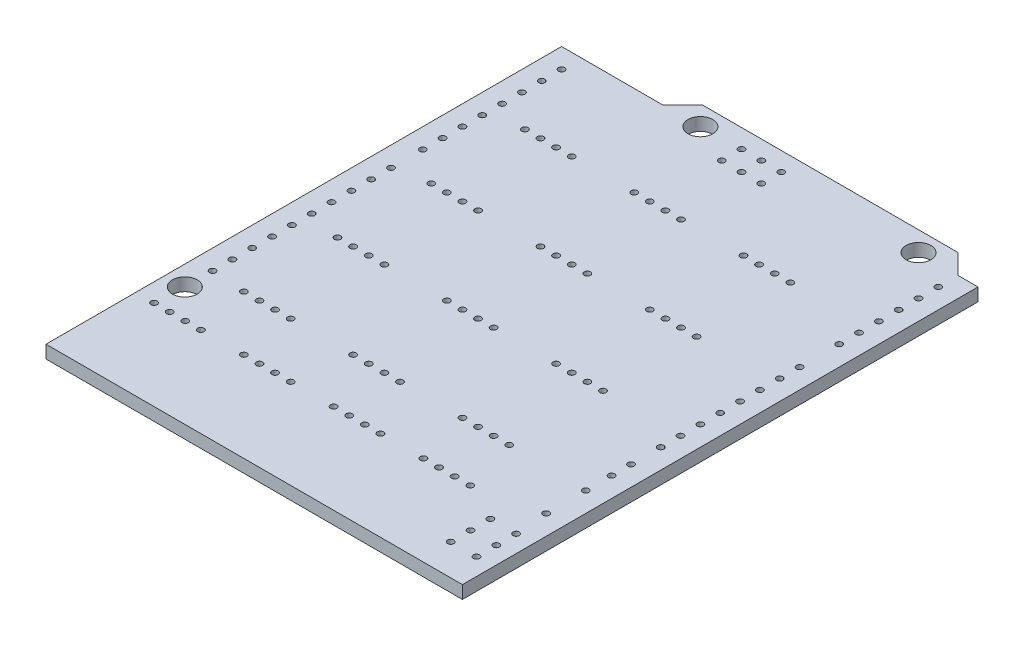
from build123d import *

# Parameters (mm, degrees)
SKETCH1_R                             = 1.5875
BOSS_EXTRUDE1_DEPTH                   = 1.65
SKETCH2_R                             = 0.4
CUT_EXTRUDE1_DEPTH                    = 1.65
SKETCH3_R                             = 0.4
CUT_EXTRUDE2_DEPTH                    = 1.65
LPATTERN1_COUNT                       = 15
LPATTERN1_PITCH                       = 2.54
SKETCH4_R                             = 0.4
CUT_EXTRUDE3_DEPTH                    = 1.65
LPATTERN2_COUNT                       = 10
LPATTERN2_PITCH                       = 2.54
LPATTERN3_COUNT                       = 8
LPATTERN3_PITCH                       = 2.54
SKETCH5_R                             = 0.4
CUT_EXTRUDE4_DEPTH                    = 10
ESQUISSE1_R                           = 0.4
ENL_V_MAT_EXTRU_1_DEPTH               = 10
R_P_TITION_LIN_AIRE1_COUNT            = 4
R_P_TITION_LIN_AIRE1_PITCH            = 2
R_P_TITION_LIN_AIRE1_COUNT_DIR2       = 4
R_P_TITION_LIN_AIRE1_PITCH_DIR2       = 11.5
ESQUISSE2_R                           = 0.4
ENL_V_MAT_EXTRU_2_DEPTH               = 10
R_P_TITION_LIN_AIRE2_COUNT            = 4
R_P_TITION_LIN_AIRE2_PITCH            = 2
R_P_TITION_LIN_AIRE2_COUNT_DIR2       = 3
R_P_TITION_LIN_AIRE2_PITCH_DIR2       = 14
R_P_TITION_LIN_AIRE3_COUNT            = 4
R_P_TITION_LIN_AIRE3_PITCH            = 12
R_P_TITION_LIN_AIRE3_COPY_1_SKETCH_R  = 0.4
R_P_TITION_LIN_AIRE3_COPY_1_DEPTH     = 10
R_P_TITION_LIN_AIRE3_COPY_2_SKETCH_R  = 0.4
R_P_TITION_LIN_AIRE3_COPY_2_DEPTH     = 10
R_P_TITION_LIN_AIRE3_COPY_3_SKETCH_R  = 0.4
R_P_TITION_LIN_AIRE3_COPY_3_DEPTH     = 10
R_P_TITION_LIN_AIRE3_COPY_4_SKETCH_R  = 0.4
R_P_TITION_LIN_AIRE3_COPY_4_DEPTH     = 10
R_P_TITION_LIN_AIRE3_COPY_5_SKETCH_R  = 0.4
R_P_TITION_LIN_AIRE3_COPY_5_DEPTH     = 10
R_P_TITION_LIN_AIRE3_COPY_6_SKETCH_R  = 0.4
R_P_TITION_LIN_AIRE3_COPY_6_DEPTH     = 10
R_P_TITION_LIN_AIRE3_COPY_7_SKETCH_R  = 0.4
R_P_TITION_LIN_AIRE3_COPY_7_DEPTH     = 10
R_P_TITION_LIN_AIRE3_COPY_8_SKETCH_R  = 0.4
R_P_TITION_LIN_AIRE3_COPY_8_DEPTH     = 10
R_P_TITION_LIN_AIRE3_COPY_9_SKETCH_R  = 0.4
R_P_TITION_LIN_AIRE3_COPY_9_DEPTH     = 10
R_P_TITION_LIN_AIRE3_COPY_10_SKETCH_R = 0.4
R_P_TITION_LIN_AIRE3_COPY_10_DEPTH    = 10
R_P_TITION_LIN_AIRE3_COPY_11_SKETCH_R = 0.4
R_P_TITION_LIN_AIRE3_COPY_11_DEPTH    = 10
R_P_TITION_LIN_AIRE3_COPY_12_SKETCH_R = 0.4
R_P_TITION_LIN_AIRE3_COPY_12_DEPTH    = 10
R_P_TITION_LIN_AIRE3_COPY_13_SKETCH_R = 0.4
R_P_TITION_LIN_AIRE3_COPY_13_DEPTH    = 10
R_P_TITION_LIN_AIRE3_COPY_14_SKETCH_R = 0.4
R_P_TITION_LIN_AIRE3_COPY_14_DEPTH    = 10
R_P_TITION_LIN_AIRE3_COPY_15_SKETCH_R = 0.4
R_P_TITION_LIN_AIRE3_COPY_15_DEPTH    = 10
R_P_TITION_LIN_AIRE3_COPY_16_SKETCH_R = 0.4
R_P_TITION_LIN_AIRE3_COPY_16_DEPTH    = 10
R_P_TITION_LIN_AIRE3_COPY_17_SKETCH_R = 0.4
R_P_TITION_LIN_AIRE3_COPY_17_DEPTH    = 10
R_P_TITION_LIN_AIRE3_COPY_18_SKETCH_R = 0.4
R_P_TITION_LIN_AIRE3_COPY_18_DEPTH    = 10
R_P_TITION_LIN_AIRE3_COPY_19_SKETCH_R = 0.4
R_P_TITION_LIN_AIRE3_COPY_19_DEPTH    = 10
R_P_TITION_LIN_AIRE3_COPY_20_SKETCH_R = 0.4
R_P_TITION_LIN_AIRE3_COPY_20_DEPTH    = 10
R_P_TITION_LIN_AIRE3_COPY_21_SKETCH_R = 0.4
R_P_TITION_LIN_AIRE3_COPY_21_DEPTH    = 10
R_P_TITION_LIN_AIRE3_COPY_22_SKETCH_R = 0.4
R_P_TITION_LIN_AIRE3_COPY_22_DEPTH    = 10
R_P_TITION_LIN_AIRE3_COPY_23_SKETCH_R = 0.4
R_P_TITION_LIN_AIRE3_COPY_23_DEPTH    = 10
R_P_TITION_LIN_AIRE3_COPY_24_SKETCH_R = 0.4
R_P_TITION_LIN_AIRE3_COPY_24_DEPTH    = 10
R_P_TITION_LIN_AIRE3_COPY_25_SKETCH_R = 0.4
R_P_TITION_LIN_AIRE3_COPY_25_DEPTH    = 10
R_P_TITION_LIN_AIRE3_COPY_26_SKETCH_R = 0.4
R_P_TITION_LIN_AIRE3_COPY_26_DEPTH    = 10
R_P_TITION_LIN_AIRE3_COPY_27_SKETCH_R = 0.4
R_P_TITION_LIN_AIRE3_COPY_27_DEPTH    = 10
R_P_TITION_LIN_AIRE3_COPY_28_SKETCH_R = 0.4
R_P_TITION_LIN_AIRE3_COPY_28_DEPTH    = 10
R_P_TITION_LIN_AIRE3_COPY_29_SKETCH_R = 0.4
R_P_TITION_LIN_AIRE3_COPY_29_DEPTH    = 10
R_P_TITION_LIN_AIRE3_COPY_30_SKETCH_R = 0.4
R_P_TITION_LIN_AIRE3_COPY_30_DEPTH    = 10
R_P_TITION_LIN_AIRE3_COPY_31_SKETCH_R = 0.4
R_P_TITION_LIN_AIRE3_COPY_31_DEPTH    = 10
R_P_TITION_LIN_AIRE3_COPY_32_SKETCH_R = 0.4
R_P_TITION_LIN_AIRE3_COPY_32_DEPTH    = 10
R_P_TITION_LIN_AIRE3_COPY_33_SKETCH_R = 0.4
R_P_TITION_LIN_AIRE3_COPY_33_DEPTH    = 10


with BuildPart() as part:
    # Sketch1 → Boss-Extrude1 (new body)
    with BuildSketch(Plane(origin=(0, 0, 0), x_dir=(1, 0, 0), z_dir=(0, 1, 0))):
        Polygon((0, 0), (-53.34, 0), (-53.34, 66.04), (-40.386, 66.04), (-37.846, 68.58), (-5.08, 68.58), (-2.54, 66.04), (0, 66.04), align=None)
        with Locations(Location((-7.62, 66.04, 0), (0, 0, 270))):
            Circle(SKETCH1_R, mode=Mode.SUBTRACT)
        with Locations(Location((-35.56, 66.04, 0), (0, 0, 270))):
            Circle(SKETCH1_R, mode=Mode.SUBTRACT)
        with Locations(Location((-50.8, 15.24, 0), (0, 0, 270))):
            Circle(SKETCH1_R, mode=Mode.SUBTRACT)
    extrude(amount=-BOSS_EXTRUDE1_DEPTH)

    # Sketch2 → Cut-Extrude1 (cut)
    with BuildSketch(Plane(origin=(0, 0, 0), x_dir=(1, 0, 0), z_dir=(0, 1, 0))):
        with Locations(Location((-2.54, 27.94, 0), (0, 0, 270))):
            Circle(SKETCH2_R)
    cut_extrude1 = extrude(amount=-CUT_EXTRUDE1_DEPTH, mode=Mode.SUBTRACT)

    # Sketch3 → Cut-Extrude2 (cut)
    with BuildSketch(Plane(origin=(0, 0, 0), x_dir=(1, 0, 0), z_dir=(0, 1, 0))):
        with Locations(Location((-50.8, 18.796, 0), (0, 0, 270))):
            Circle(SKETCH3_R)
    cut_extrude2 = extrude(amount=-CUT_EXTRUDE2_DEPTH, mode=Mode.SUBTRACT)

    # LPattern1: Cut-Extrude1 ×15, 1 skipped
    with Locations(*[(0, 0, -i * LPATTERN1_PITCH) for i in range(1, LPATTERN1_COUNT) if i not in (8,)]):
        add(cut_extrude1, mode=Mode.SUBTRACT)

    # Sketch4 → Cut-Extrude3 (cut)
    with BuildSketch(Plane(origin=(0, 0, 0), x_dir=(1, 0, 0), z_dir=(0, 1, 0))):
        with Locations(Location((-50.8, 45.72, 0), (0, 0, 270))):
            Circle(SKETCH4_R)
    cut_extrude3 = extrude(amount=-CUT_EXTRUDE3_DEPTH, mode=Mode.SUBTRACT)

    # LPattern2: Cut-Extrude2 ×10
    with Locations(*[(0, 0, -i * LPATTERN2_PITCH) for i in range(1, LPATTERN2_COUNT)]):
        add(cut_extrude2, mode=Mode.SUBTRACT)

    # LPattern3: Cut-Extrude3 ×8
    with Locations(*[(0, 0, -i * LPATTERN3_PITCH) for i in range(1, LPATTERN3_COUNT)]):
        add(cut_extrude3, mode=Mode.SUBTRACT)

    # Sketch5 → Cut-Extrude4 (cut)
    with BuildSketch(Plane(origin=(0, 0, 0), x_dir=(1, 0, 0), z_dir=(0, 1, 0))):
        with Locations(Location((-30.43, 66.18, 0), (0, 0, 270))):
            Circle(SKETCH5_R)
        with Locations(Location((-27.89, 66.18, 0), (0, 0, 270))):
            Circle(SKETCH5_R)
        with Locations(Location((-25.35, 66.18, 0), (0, 0, 270))):
            Circle(SKETCH5_R)
        with Locations(Location((-25.35, 63.64, 0), (0, 0, 270))):
            Circle(SKETCH5_R)
        with Locations(Location((-27.89, 63.64, 0), (0, 0, 270))):
            Circle(SKETCH5_R)
        with Locations(Location((-30.43, 63.64, 0), (0, 0, 270))):
            Circle(SKETCH5_R)
        with Locations(Location((-5.5, 4, 0), (0, 0, 270))):
            Circle(SKETCH5_R)
        with Locations(Location((-5.5, 6.54, 0), (0, 0, 270))):
            Circle(SKETCH5_R)
        with Locations(Location((-5.5, 9.08, 0), (0, 0, 270))):
            Circle(SKETCH5_R)
        with Locations(Location((-2.2, 9.08, 0), (0, 0, 270))):
            Circle(SKETCH5_R)
        with Locations(Location((-2.2, 6.54, 0), (0, 0, 270))):
            Circle(SKETCH5_R)
        with Locations(Location((-2.2, 4, 0), (0, 0, 270))):
            Circle(SKETCH5_R)
        with Locations(Location((-2.54, 24.14, 0), (0, 0, 270))):
            Circle(SKETCH5_R)
        with Locations(Location((-2.54, 21.64, 0), (0, 0, 270))):
            Circle(SKETCH5_R)
        with Locations(Location((-2.54, 18.34, 0), (0, 0, 270))):
            Circle(SKETCH5_R)
        with Locations(Location((-2.54, 13.26, 0), (0, 0, 270))):
            Circle(SKETCH5_R)
    extrude(amount=-CUT_EXTRUDE4_DEPTH, mode=Mode.SUBTRACT)

    # Esquisse1 → Enlèv. mat.-Extru.1 (cut)
    with BuildSketch(Plane.XZ.offset(1.65)):
        with Locations(Location((-10.5, -11.5, 0), (0, 0, 270))):
            Circle(ESQUISSE1_R)
    enl_v_mat_extru_1 = extrude(amount=-ENL_V_MAT_EXTRU_1_DEPTH, mode=Mode.SUBTRACT)

    # Répétition linéaire1: Enl_v. mat.-Extru.1 4 × 4
    with Locations(*[Vector(-1, 0, 0) * (i * R_P_TITION_LIN_AIRE1_PITCH) + Vector(-1, 0, 0) * (j * R_P_TITION_LIN_AIRE1_PITCH_DIR2) for i in range(R_P_TITION_LIN_AIRE1_COUNT) for j in range(R_P_TITION_LIN_AIRE1_COUNT_DIR2) if (i, j) != (0, 0)]):
        add(enl_v_mat_extru_1, mode=Mode.SUBTRACT)

    # Esquisse2 → Enlèv. mat.-Extru.2 (cut)
    with BuildSketch(Plane.XZ.offset(1.65)):
        with Locations(Location((-12.5, -18.5, 0), (0, 0, 270))):
            Circle(ESQUISSE2_R)
    enl_v_mat_extru_2 = extrude(amount=-ENL_V_MAT_EXTRU_2_DEPTH, mode=Mode.SUBTRACT)

    # Répétition linéaire2: Enl_v. mat.-Extru.2 4 × 3
    with Locations(*[Vector(-1, 0, 0) * (i * R_P_TITION_LIN_AIRE2_PITCH) + Vector(-1, 0, 0) * (j * R_P_TITION_LIN_AIRE2_PITCH_DIR2) for i in range(R_P_TITION_LIN_AIRE2_COUNT) for j in range(R_P_TITION_LIN_AIRE2_COUNT_DIR2) if (i, j) != (0, 0)]):
        add(enl_v_mat_extru_2, mode=Mode.SUBTRACT)

    # Répétition linéaire3: Enlèv. mat.-Extru.2 ×4
    with Locations(*[(0, 0, -i * R_P_TITION_LIN_AIRE3_PITCH) for i in range(1, R_P_TITION_LIN_AIRE3_COUNT)]):
        add(enl_v_mat_extru_2, mode=Mode.SUBTRACT)

    # Répétition linéaire3 copy 1 sketch → Répétition linéaire3 copy 1 (cut)
    with BuildSketch(Plane(origin=(-14, -1.65, -12), x_dir=(1, 0, 0), z_dir=(0, -1, 0))):
        with Locations(Location((-12.5, -18.5, 0), (0, 0, 270))):
            Circle(R_P_TITION_LIN_AIRE3_COPY_1_SKETCH_R)
    extrude(amount=-R_P_TITION_LIN_AIRE3_COPY_1_DEPTH, mode=Mode.SUBTRACT)

    # Répétition linéaire3 copy 2 sketch → Répétition linéaire3 copy 2 (cut)
    with BuildSketch(Plane(origin=(-14, -1.65, -24), x_dir=(1, 0, 0), z_dir=(0, -1, 0))):
        with Locations(Location((-12.5, -18.5, 0), (0, 0, 270))):
            Circle(R_P_TITION_LIN_AIRE3_COPY_2_SKETCH_R)
    extrude(amount=-R_P_TITION_LIN_AIRE3_COPY_2_DEPTH, mode=Mode.SUBTRACT)

    # Répétition linéaire3 copy 3 sketch → Répétition linéaire3 copy 3 (cut)
    with BuildSketch(Plane(origin=(-14, -1.65, -36), x_dir=(1, 0, 0), z_dir=(0, -1, 0))):
        with Locations(Location((-12.5, -18.5, 0), (0, 0, 270))):
            Circle(R_P_TITION_LIN_AIRE3_COPY_3_SKETCH_R)
    extrude(amount=-R_P_TITION_LIN_AIRE3_COPY_3_DEPTH, mode=Mode.SUBTRACT)

    # Répétition linéaire3 copy 4 sketch → Répétition linéaire3 copy 4 (cut)
    with BuildSketch(Plane(origin=(-28, -1.65, -12), x_dir=(1, 0, 0), z_dir=(0, -1, 0))):
        with Locations(Location((-12.5, -18.5, 0), (0, 0, 270))):
            Circle(R_P_TITION_LIN_AIRE3_COPY_4_SKETCH_R)
    extrude(amount=-R_P_TITION_LIN_AIRE3_COPY_4_DEPTH, mode=Mode.SUBTRACT)

    # Répétition linéaire3 copy 5 sketch → Répétition linéaire3 copy 5 (cut)
    with BuildSketch(Plane(origin=(-28, -1.65, -24), x_dir=(1, 0, 0), z_dir=(0, -1, 0))):
        with Locations(Location((-12.5, -18.5, 0), (0, 0, 270))):
            Circle(R_P_TITION_LIN_AIRE3_COPY_5_SKETCH_R)
    extrude(amount=-R_P_TITION_LIN_AIRE3_COPY_5_DEPTH, mode=Mode.SUBTRACT)

    # Répétition linéaire3 copy 6 sketch → Répétition linéaire3 copy 6 (cut)
    with BuildSketch(Plane(origin=(-28, -1.65, -36), x_dir=(1, 0, 0), z_dir=(0, -1, 0))):
        with Locations(Location((-12.5, -18.5, 0), (0, 0, 270))):
            Circle(R_P_TITION_LIN_AIRE3_COPY_6_SKETCH_R)
    extrude(amount=-R_P_TITION_LIN_AIRE3_COPY_6_DEPTH, mode=Mode.SUBTRACT)

    # Répétition linéaire3 copy 7 sketch → Répétition linéaire3 copy 7 (cut)
    with BuildSketch(Plane(origin=(-2, -1.65, -12), x_dir=(1, 0, 0), z_dir=(0, -1, 0))):
        with Locations(Location((-12.5, -18.5, 0), (0, 0, 270))):
            Circle(R_P_TITION_LIN_AIRE3_COPY_7_SKETCH_R)
    extrude(amount=-R_P_TITION_LIN_AIRE3_COPY_7_DEPTH, mode=Mode.SUBTRACT)

    # Répétition linéaire3 copy 8 sketch → Répétition linéaire3 copy 8 (cut)
    with BuildSketch(Plane(origin=(-2, -1.65, -24), x_dir=(1, 0, 0), z_dir=(0, -1, 0))):
        with Locations(Location((-12.5, -18.5, 0), (0, 0, 270))):
            Circle(R_P_TITION_LIN_AIRE3_COPY_8_SKETCH_R)
    extrude(amount=-R_P_TITION_LIN_AIRE3_COPY_8_DEPTH, mode=Mode.SUBTRACT)

    # Répétition linéaire3 copy 9 sketch → Répétition linéaire3 copy 9 (cut)
    with BuildSketch(Plane(origin=(-2, -1.65, -36), x_dir=(1, 0, 0), z_dir=(0, -1, 0))):
        with Locations(Location((-12.5, -18.5, 0), (0, 0, 270))):
            Circle(R_P_TITION_LIN_AIRE3_COPY_9_SKETCH_R)
    extrude(amount=-R_P_TITION_LIN_AIRE3_COPY_9_DEPTH, mode=Mode.SUBTRACT)

    # Répétition linéaire3 copy 10 sketch → Répétition linéaire3 copy 10 (cut)
    with BuildSketch(Plane(origin=(-16, -1.65, -12), x_dir=(1, 0, 0), z_dir=(0, -1, 0))):
        with Locations(Location((-12.5, -18.5, 0), (0, 0, 270))):
            Circle(R_P_TITION_LIN_AIRE3_COPY_10_SKETCH_R)
    extrude(amount=-R_P_TITION_LIN_AIRE3_COPY_10_DEPTH, mode=Mode.SUBTRACT)

    # Répétition linéaire3 copy 11 sketch → Répétition linéaire3 copy 11 (cut)
    with BuildSketch(Plane(origin=(-16, -1.65, -24), x_dir=(1, 0, 0), z_dir=(0, -1, 0))):
        with Locations(Location((-12.5, -18.5, 0), (0, 0, 270))):
            Circle(R_P_TITION_LIN_AIRE3_COPY_11_SKETCH_R)
    extrude(amount=-R_P_TITION_LIN_AIRE3_COPY_11_DEPTH, mode=Mode.SUBTRACT)

    # Répétition linéaire3 copy 12 sketch → Répétition linéaire3 copy 12 (cut)
    with BuildSketch(Plane(origin=(-16, -1.65, -36), x_dir=(1, 0, 0), z_dir=(0, -1, 0))):
        with Locations(Location((-12.5, -18.5, 0), (0, 0, 270))):
            Circle(R_P_TITION_LIN_AIRE3_COPY_12_SKETCH_R)
    extrude(amount=-R_P_TITION_LIN_AIRE3_COPY_12_DEPTH, mode=Mode.SUBTRACT)

    # Répétition linéaire3 copy 13 sketch → Répétition linéaire3 copy 13 (cut)
    with BuildSketch(Plane(origin=(-30, -1.65, -12), x_dir=(1, 0, 0), z_dir=(0, -1, 0))):
        with Locations(Location((-12.5, -18.5, 0), (0, 0, 270))):
            Circle(R_P_TITION_LIN_AIRE3_COPY_13_SKETCH_R)
    extrude(amount=-R_P_TITION_LIN_AIRE3_COPY_13_DEPTH, mode=Mode.SUBTRACT)

    # Répétition linéaire3 copy 14 sketch → Répétition linéaire3 copy 14 (cut)
    with BuildSketch(Plane(origin=(-30, -1.65, -24), x_dir=(1, 0, 0), z_dir=(0, -1, 0))):
        with Locations(Location((-12.5, -18.5, 0), (0, 0, 270))):
            Circle(R_P_TITION_LIN_AIRE3_COPY_14_SKETCH_R)
    extrude(amount=-R_P_TITION_LIN_AIRE3_COPY_14_DEPTH, mode=Mode.SUBTRACT)

    # Répétition linéaire3 copy 15 sketch → Répétition linéaire3 copy 15 (cut)
    with BuildSketch(Plane(origin=(-30, -1.65, -36), x_dir=(1, 0, 0), z_dir=(0, -1, 0))):
        with Locations(Location((-12.5, -18.5, 0), (0, 0, 270))):
            Circle(R_P_TITION_LIN_AIRE3_COPY_15_SKETCH_R)
    extrude(amount=-R_P_TITION_LIN_AIRE3_COPY_15_DEPTH, mode=Mode.SUBTRACT)

    # Répétition linéaire3 copy 16 sketch → Répétition linéaire3 copy 16 (cut)
    with BuildSketch(Plane(origin=(-4, -1.65, -12), x_dir=(1, 0, 0), z_dir=(0, -1, 0))):
        with Locations(Location((-12.5, -18.5, 0), (0, 0, 270))):
            Circle(R_P_TITION_LIN_AIRE3_COPY_16_SKETCH_R)
    extrude(amount=-R_P_TITION_LIN_AIRE3_COPY_16_DEPTH, mode=Mode.SUBTRACT)

    # Répétition linéaire3 copy 17 sketch → Répétition linéaire3 copy 17 (cut)
    with BuildSketch(Plane(origin=(-4, -1.65, -24), x_dir=(1, 0, 0), z_dir=(0, -1, 0))):
        with Locations(Location((-12.5, -18.5, 0), (0, 0, 270))):
            Circle(R_P_TITION_LIN_AIRE3_COPY_17_SKETCH_R)
    extrude(amount=-R_P_TITION_LIN_AIRE3_COPY_17_DEPTH, mode=Mode.SUBTRACT)

    # Répétition linéaire3 copy 18 sketch → Répétition linéaire3 copy 18 (cut)
    with BuildSketch(Plane(origin=(-4, -1.65, -36), x_dir=(1, 0, 0), z_dir=(0, -1, 0))):
        with Locations(Location((-12.5, -18.5, 0), (0, 0, 270))):
            Circle(R_P_TITION_LIN_AIRE3_COPY_18_SKETCH_R)
    extrude(amount=-R_P_TITION_LIN_AIRE3_COPY_18_DEPTH, mode=Mode.SUBTRACT)

    # Répétition linéaire3 copy 19 sketch → Répétition linéaire3 copy 19 (cut)
    with BuildSketch(Plane(origin=(-18, -1.65, -12), x_dir=(1, 0, 0), z_dir=(0, -1, 0))):
        with Locations(Location((-12.5, -18.5, 0), (0, 0, 270))):
            Circle(R_P_TITION_LIN_AIRE3_COPY_19_SKETCH_R)
    extrude(amount=-R_P_TITION_LIN_AIRE3_COPY_19_DEPTH, mode=Mode.SUBTRACT)

    # Répétition linéaire3 copy 20 sketch → Répétition linéaire3 copy 20 (cut)
    with BuildSketch(Plane(origin=(-18, -1.65, -24), x_dir=(1, 0, 0), z_dir=(0, -1, 0))):
        with Locations(Location((-12.5, -18.5, 0), (0, 0, 270))):
            Circle(R_P_TITION_LIN_AIRE3_COPY_20_SKETCH_R)
    extrude(amount=-R_P_TITION_LIN_AIRE3_COPY_20_DEPTH, mode=Mode.SUBTRACT)

    # Répétition linéaire3 copy 21 sketch → Répétition linéaire3 copy 21 (cut)
    with BuildSketch(Plane(origin=(-18, -1.65, -36), x_dir=(1, 0, 0), z_dir=(0, -1, 0))):
        with Locations(Location((-12.5, -18.5, 0), (0, 0, 270))):
            Circle(R_P_TITION_LIN_AIRE3_COPY_21_SKETCH_R)
    extrude(amount=-R_P_TITION_LIN_AIRE3_COPY_21_DEPTH, mode=Mode.SUBTRACT)

    # Répétition linéaire3 copy 22 sketch → Répétition linéaire3 copy 22 (cut)
    with BuildSketch(Plane(origin=(-32, -1.65, -12), x_dir=(1, 0, 0), z_dir=(0, -1, 0))):
        with Locations(Location((-12.5, -18.5, 0), (0, 0, 270))):
            Circle(R_P_TITION_LIN_AIRE3_COPY_22_SKETCH_R)
    extrude(amount=-R_P_TITION_LIN_AIRE3_COPY_22_DEPTH, mode=Mode.SUBTRACT)

    # Répétition linéaire3 copy 23 sketch → Répétition linéaire3 copy 23 (cut)
    with BuildSketch(Plane(origin=(-32, -1.65, -24), x_dir=(1, 0, 0), z_dir=(0, -1, 0))):
        with Locations(Location((-12.5, -18.5, 0), (0, 0, 270))):
            Circle(R_P_TITION_LIN_AIRE3_COPY_23_SKETCH_R)
    extrude(amount=-R_P_TITION_LIN_AIRE3_COPY_23_DEPTH, mode=Mode.SUBTRACT)

    # Répétition linéaire3 copy 24 sketch → Répétition linéaire3 copy 24 (cut)
    with BuildSketch(Plane(origin=(-32, -1.65, -36), x_dir=(1, 0, 0), z_dir=(0, -1, 0))):
        with Locations(Location((-12.5, -18.5, 0), (0, 0, 270))):
            Circle(R_P_TITION_LIN_AIRE3_COPY_24_SKETCH_R)
    extrude(amount=-R_P_TITION_LIN_AIRE3_COPY_24_DEPTH, mode=Mode.SUBTRACT)

    # Répétition linéaire3 copy 25 sketch → Répétition linéaire3 copy 25 (cut)
    with BuildSketch(Plane(origin=(-6, -1.65, -12), x_dir=(1, 0, 0), z_dir=(0, -1, 0))):
        with Locations(Location((-12.5, -18.5, 0), (0, 0, 270))):
            Circle(R_P_TITION_LIN_AIRE3_COPY_25_SKETCH_R)
    extrude(amount=-R_P_TITION_LIN_AIRE3_COPY_25_DEPTH, mode=Mode.SUBTRACT)

    # Répétition linéaire3 copy 26 sketch → Répétition linéaire3 copy 26 (cut)
    with BuildSketch(Plane(origin=(-6, -1.65, -24), x_dir=(1, 0, 0), z_dir=(0, -1, 0))):
        with Locations(Location((-12.5, -18.5, 0), (0, 0, 270))):
            Circle(R_P_TITION_LIN_AIRE3_COPY_26_SKETCH_R)
    extrude(amount=-R_P_TITION_LIN_AIRE3_COPY_26_DEPTH, mode=Mode.SUBTRACT)

    # Répétition linéaire3 copy 27 sketch → Répétition linéaire3 copy 27 (cut)
    with BuildSketch(Plane(origin=(-6, -1.65, -36), x_dir=(1, 0, 0), z_dir=(0, -1, 0))):
        with Locations(Location((-12.5, -18.5, 0), (0, 0, 270))):
            Circle(R_P_TITION_LIN_AIRE3_COPY_27_SKETCH_R)
    extrude(amount=-R_P_TITION_LIN_AIRE3_COPY_27_DEPTH, mode=Mode.SUBTRACT)

    # Répétition linéaire3 copy 28 sketch → Répétition linéaire3 copy 28 (cut)
    with BuildSketch(Plane(origin=(-20, -1.65, -12), x_dir=(1, 0, 0), z_dir=(0, -1, 0))):
        with Locations(Location((-12.5, -18.5, 0), (0, 0, 270))):
            Circle(R_P_TITION_LIN_AIRE3_COPY_28_SKETCH_R)
    extrude(amount=-R_P_TITION_LIN_AIRE3_COPY_28_DEPTH, mode=Mode.SUBTRACT)

    # Répétition linéaire3 copy 29 sketch → Répétition linéaire3 copy 29 (cut)
    with BuildSketch(Plane(origin=(-20, -1.65, -24), x_dir=(1, 0, 0), z_dir=(0, -1, 0))):
        with Locations(Location((-12.5, -18.5, 0), (0, 0, 270))):
            Circle(R_P_TITION_LIN_AIRE3_COPY_29_SKETCH_R)
    extrude(amount=-R_P_TITION_LIN_AIRE3_COPY_29_DEPTH, mode=Mode.SUBTRACT)

    # Répétition linéaire3 copy 30 sketch → Répétition linéaire3 copy 30 (cut)
    with BuildSketch(Plane(origin=(-20, -1.65, -36), x_dir=(1, 0, 0), z_dir=(0, -1, 0))):
        with Locations(Location((-12.5, -18.5, 0), (0, 0, 270))):
            Circle(R_P_TITION_LIN_AIRE3_COPY_30_SKETCH_R)
    extrude(amount=-R_P_TITION_LIN_AIRE3_COPY_30_DEPTH, mode=Mode.SUBTRACT)

    # Répétition linéaire3 copy 31 sketch → Répétition linéaire3 copy 31 (cut)
    with BuildSketch(Plane(origin=(-34, -1.65, -12), x_dir=(1, 0, 0), z_dir=(0, -1, 0))):
        with Locations(Location((-12.5, -18.5, 0), (0, 0, 270))):
            Circle(R_P_TITION_LIN_AIRE3_COPY_31_SKETCH_R)
    extrude(amount=-R_P_TITION_LIN_AIRE3_COPY_31_DEPTH, mode=Mode.SUBTRACT)

    # Répétition linéaire3 copy 32 sketch → Répétition linéaire3 copy 32 (cut)
    with BuildSketch(Plane(origin=(-34, -1.65, -24), x_dir=(1, 0, 0), z_dir=(0, -1, 0))):
        with Locations(Location((-12.5, -18.5, 0), (0, 0, 270))):
            Circle(R_P_TITION_LIN_AIRE3_COPY_32_SKETCH_R)
    extrude(amount=-R_P_TITION_LIN_AIRE3_COPY_32_DEPTH, mode=Mode.SUBTRACT)

    # Répétition linéaire3 copy 33 sketch → Répétition linéaire3 copy 33 (cut)
    with BuildSketch(Plane(origin=(-34, -1.65, -36), x_dir=(1, 0, 0), z_dir=(0, -1, 0))):
        with Locations(Location((-12.5, -18.5, 0), (0, 0, 270))):
            Circle(R_P_TITION_LIN_AIRE3_COPY_33_SKETCH_R)
    extrude(amount=-R_P_TITION_LIN_AIRE3_COPY_33_DEPTH, mode=Mode.SUBTRACT)


solid = part.part
